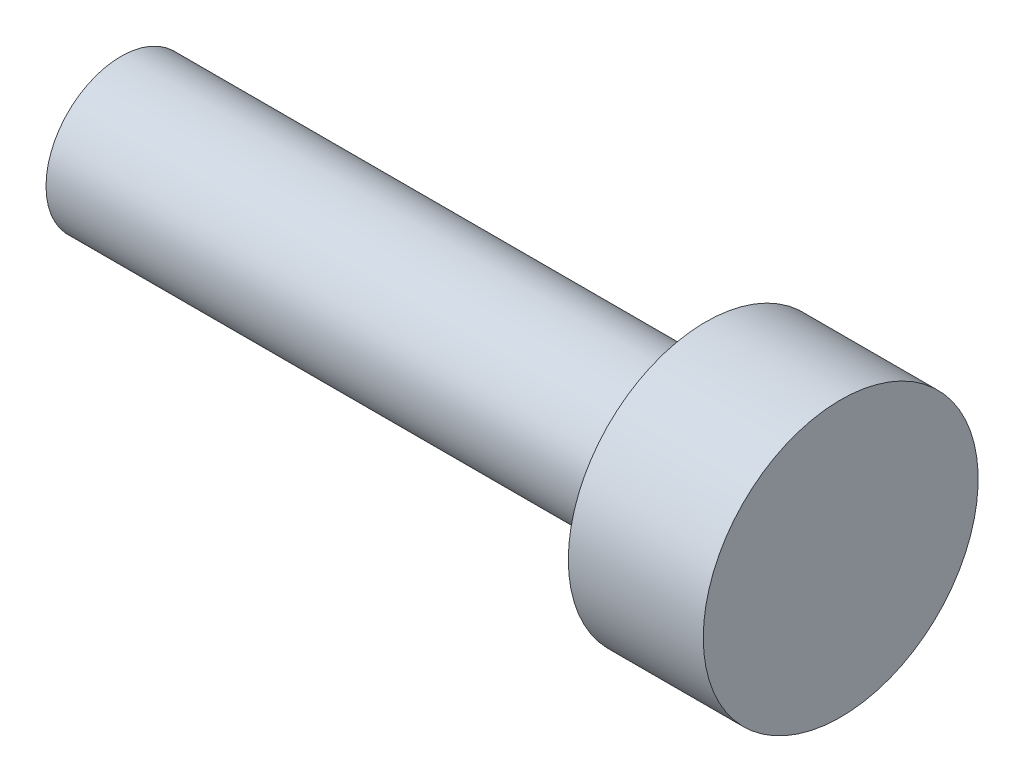
from build123d import *


with BuildPart() as part:
    # Axial profile (mm) → Full revolution (revolve)
    with BuildSketch(Plane.XY, mode=Mode.PRIVATE) as full_revolution_sk:
        Polygon((165, 0), (179.4, 0), (179.4, 2.75), (176.7, 2.75), (176.7, 1.5), (165, 1.5), align=None)
    revolve(full_revolution_sk.sketch.rotate(Axis((-110, 0, 0), (1, 0, 0)), 90), axis=Axis((-110, 0, 0), (1, 0, 0)))


solid = part.part
